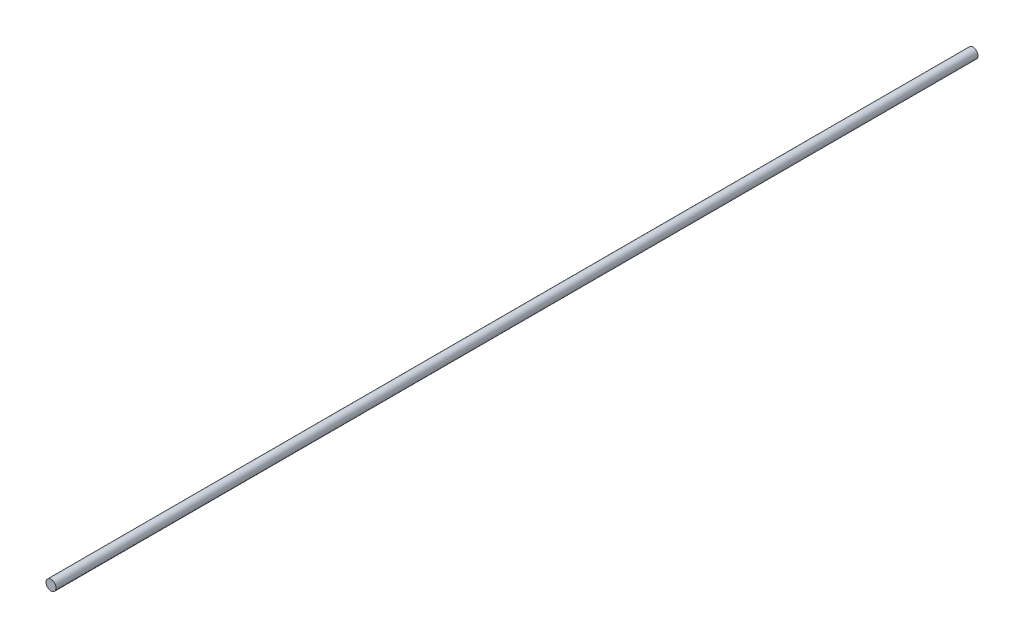
from build123d import *

# Parameters (mm, degrees)
SKETCH_1_R                        = 2
DRIVER_POWER_CABLE_ENVELOPE_DEPTH = 367.604406938


with BuildPart() as part:
    # 草图1 → Driver_power_cable_envelope (new body)
    with BuildSketch(Plane.XY):
        Circle(SKETCH_1_R)
    extrude(amount=DRIVER_POWER_CABLE_ENVELOPE_DEPTH)


solid = part.part
